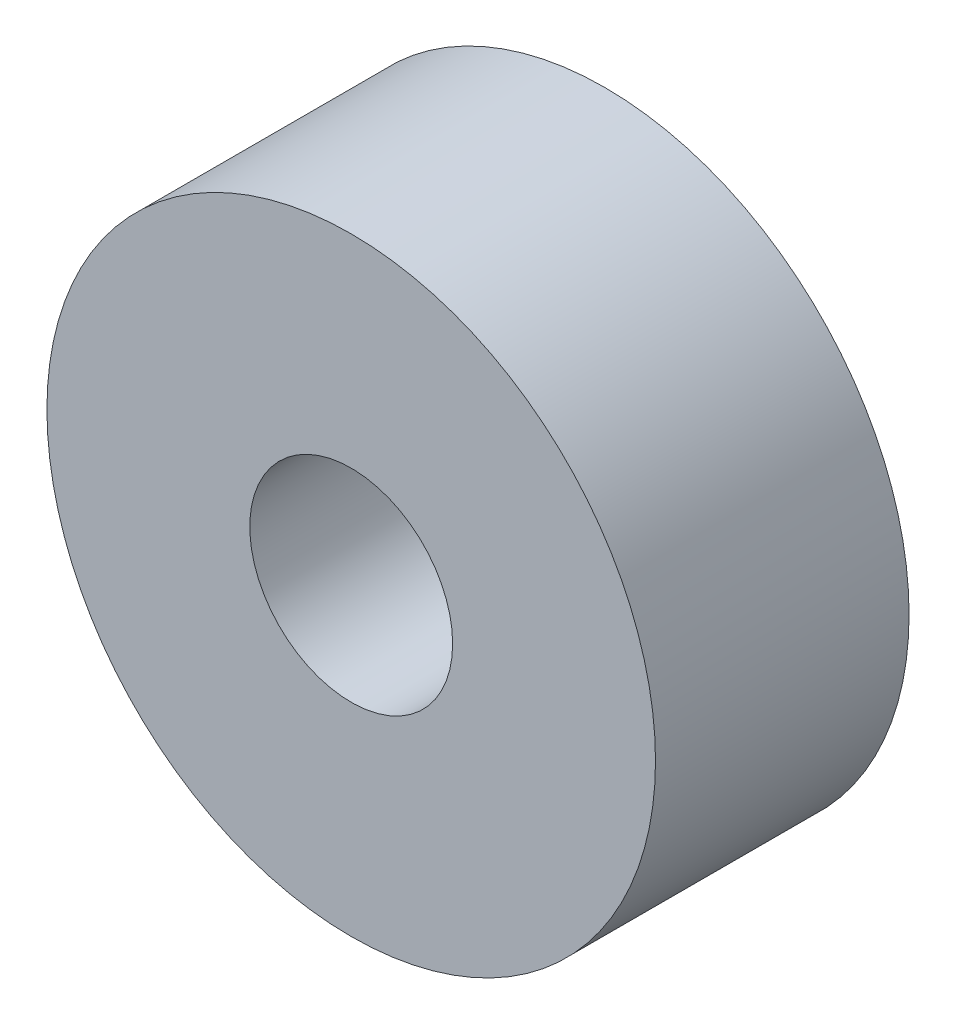
from build123d import *

# Parameters (mm, degrees)
SKETCH2_R           = 12
SKETCH2_R_2         = 4
BOSS_EXTRUDE1_DEPTH = 10


with BuildPart() as part:
    # Sketch2 → Boss-Extrude1 (new body)
    with BuildSketch(Plane(origin=(0, 0, 0), x_dir=(0, 1, 0), z_dir=(0, 0, 1))):
        with Locations(Location((0, 0, 0), (0, 0, 270))):
            Circle(SKETCH2_R)
        with Locations(Location((0, 0, 0), (0, 0, 270))):
            Circle(SKETCH2_R_2, mode=Mode.SUBTRACT)
    extrude(amount=BOSS_EXTRUDE1_DEPTH)


solid = part.part
